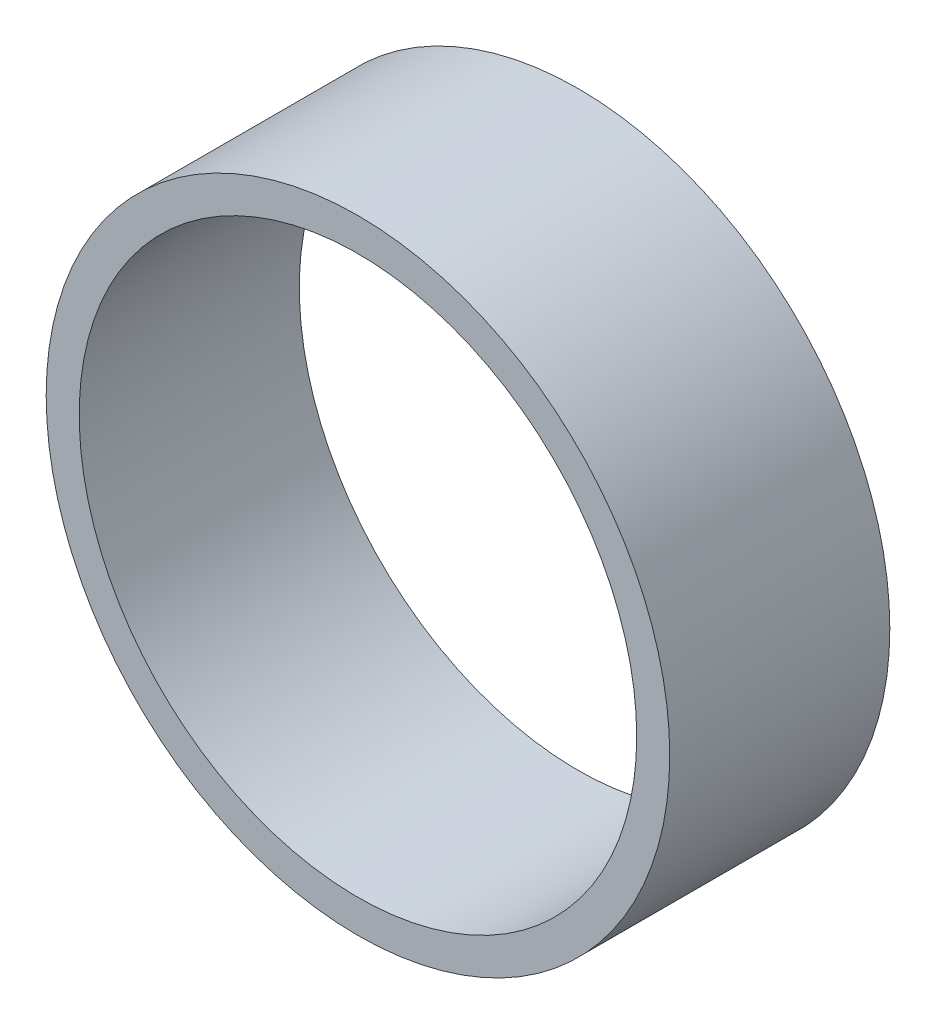
from build123d import *

# Parameters (mm, degrees)
SKETCH1_R           = 53.975
BOSS_EXTRUDE1_DEPTH = 38.1
SKETCH2_R           = 48.26
CUT_EXTRUDE1_DEPTH  = 86.31243315


with BuildPart() as part:
    # Sketch1 → Boss-Extrude1 (new body)
    with BuildSketch(Plane.XY):
        with Locations(Location((0, 0, 0), (0, 0, 180))):
            Circle(SKETCH1_R)
    extrude(amount=BOSS_EXTRUDE1_DEPTH)

    # Sketch2 → Cut-Extrude1 (cut, through all)
    with BuildSketch(Plane.XY.offset(38.1)):
        Circle(SKETCH2_R)
    extrude(amount=-CUT_EXTRUDE1_DEPTH, mode=Mode.SUBTRACT)


solid = part.part
